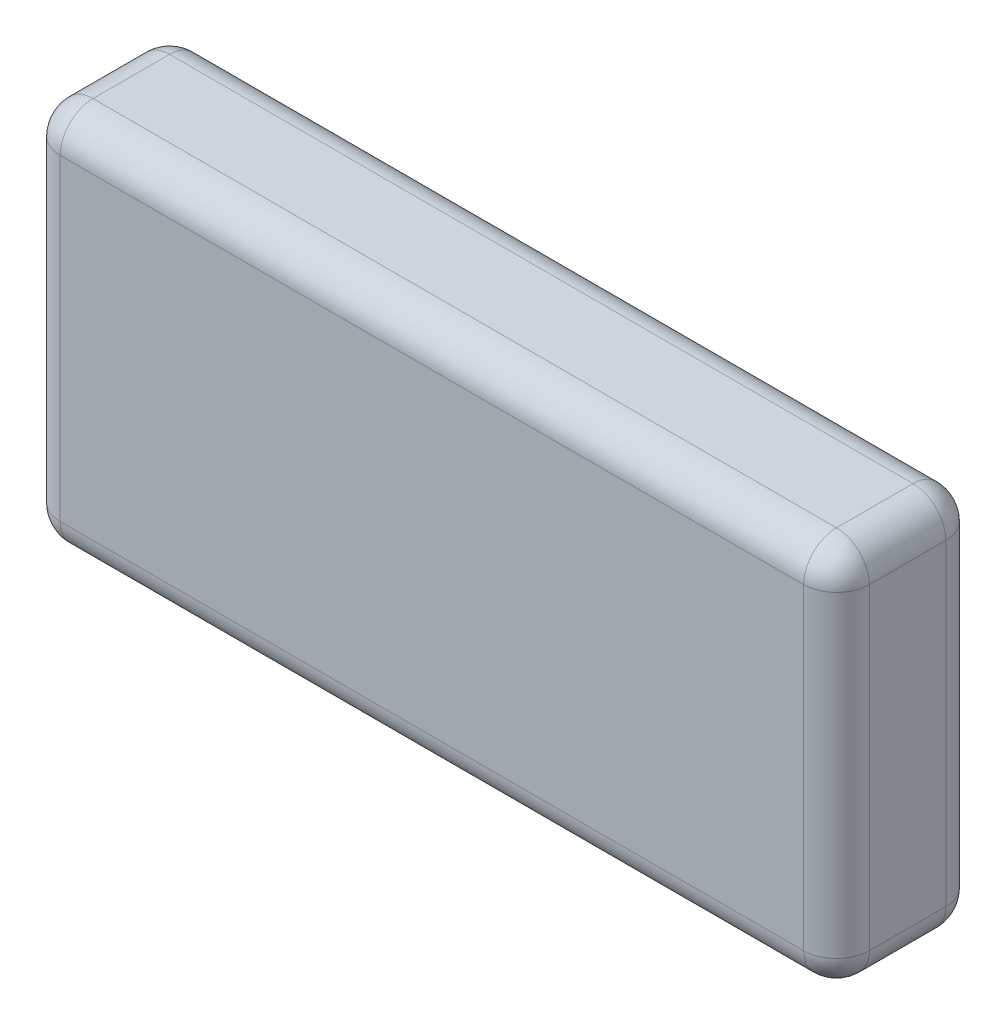
from build123d import *

# Parameters (mm, degrees)
ESBO_O1_W                = 74
ESBO_O1_H                = 35
RESSALTO_EXTRUS_O1_DEPTH = 13
FILETE1_R                = 3


with BuildPart() as part:
    # Esboço1 → Ressalto-extrusão1 (new body)
    with BuildSketch(Plane.XY):
        with Locations((9.887808176, 8.484302723)):
            Rectangle(ESBO_O1_W, ESBO_O1_H)
    extrude(amount=RESSALTO_EXTRUS_O1_DEPTH)

    # Filete1
    filete1_edges = [part.edges().sort_by_distance(p)[0] for p in [
        (46.887808176, 8.484302723, 13),
        (9.887808176, 25.984302723, 13),
        (-27.112191824, 8.484302723, 13),
        (9.887808176, 25.984302723, 0),
        (46.887808176, 8.484302723, 0),
        (9.887808176, -9.015697277, 0),
        (-27.112191824, 8.484302723, 0),
        (9.887808176, -9.015697277, 13),
        (-27.112191824, 25.984302723, 6.5),
        (46.887808176, 25.984302723, 6.5),
        (46.887808176, -9.015697277, 6.5),
        (-27.112191824, -9.015697277, 6.5),
    ]]
    fillet(filete1_edges, radius=FILETE1_R)


solid = part.part
